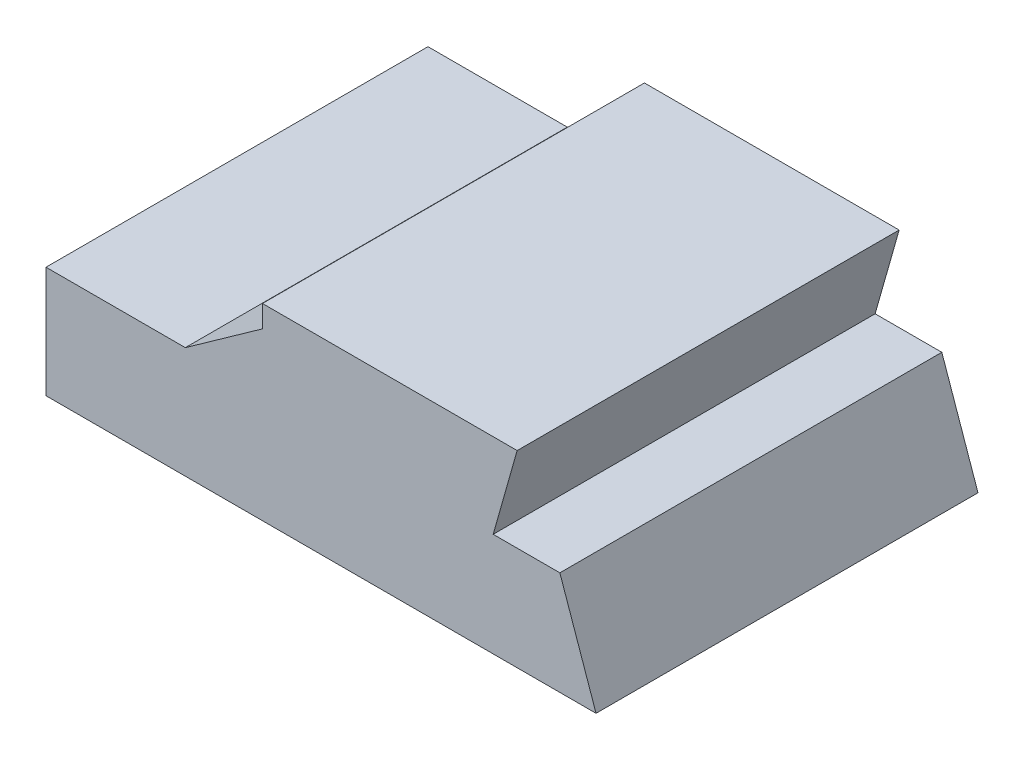
from build123d import *

# Parameters (mm, degrees)
SKETCH_1_R                     = 27.218239916
EXTRUDE_1_DEPTH                = 50
SPLIT_BODIES_1_SURFACE_1_BACK  = 231.852
SPLIT_BODIES_1_SURFACE_1_DEPTH = 463.704
SPLIT_BODIES_1_SURFACE_2_BACK  = 231.852
SPLIT_BODIES_1_SURFACE_2_DEPTH = 463.704


with BuildPart() as part:
    # 草图1 → 凸台-拉伸1 (new, symmetric)
    with BuildSketch(Plane.XY):
        with Locations((126.841, 106.1775)):
            Circle(SKETCH_1_R)
        with BuildLine():
            Line((36.476006197, 29.147891414), (56.67204093, 43.504108875))
            Line((56.67204093, 43.504108875), (56.67204093, 93.307484045))
            Line((56.67204093, 93.307484045), (92.496172884, 93.307484045))
            ThreePointArc((92.496172884, 93.307484045), (88.507151815, 108.556758389), (81.393508143, 122.622629526))
            ThreePointArc((81.393508143, 122.622629526), (81.328816917, 131.844883349), (89.661, 135.798220622))
            Line((89.661, 135.798220622), (152.57565846, 127.931864381))
            ThreePointArc((152.57565846, 127.931864381), (156.589044848, 125.482703859), (157.411382406, 120.853511867))
            Line((157.411382406, 120.853511867), (139.303205185, 49.257428232))
            Line((139.303205185, 49.257428232), (123.353516134, 49.257428232))
            Line((123.353516134, 49.257428232), (117.072161438, 27.122156161))
            Line((117.072161438, 27.122156161), (134.529857437, 27.122156161))
            Line((134.529857437, 27.122156161), (144.001, 0))
            Line((144.001, 0), (0, 0))
            Line((0, 0), (0, 29.147891414))
            Line((0, 29.147891414), (36.476006197, 29.147891414))
        make_face()
    extrude(amount=EXTRUDE_1_DEPTH, both=True)


with BuildPart() as body_2:
    # Split Bodies 1: the piece behind the surface
    add(part.part)
    # Split Bodies 1 surface: a surface, the sketch's curves swept straight by 463.704 mm
    with BuildLine(Plane.XY.offset(50).offset(-SPLIT_BODIES_1_SURFACE_1_BACK), mode=Mode.PRIVATE) as split_bodies_1_surface_1_path:
        Line((123.353516134, 49.257428232), (56.67204093, 49.257428232))
    split_bodies_1_surface_1 = Shell.extrude(split_bodies_1_surface_1_path.wire(), (0 * SPLIT_BODIES_1_SURFACE_1_DEPTH, 0 * SPLIT_BODIES_1_SURFACE_1_DEPTH, 1 * SPLIT_BODIES_1_SURFACE_1_DEPTH))
    split(bisect_by=split_bodies_1_surface_1, keep=Keep.BOTTOM)


with BuildPart() as part_1:
    add(part.part)

    # Split Bodies 1: split by a surface, the side it looks to stays
    # Split Bodies 1 surface: a surface, the sketch's curves swept straight by 463.704 mm
    with BuildLine(Plane.XY.offset(50).offset(-SPLIT_BODIES_1_SURFACE_2_BACK), mode=Mode.PRIVATE) as split_bodies_1_surface_2_path:
        Line((123.353516134, 49.257428232), (56.67204093, 49.257428232))
    split_bodies_1_surface_2 = Shell.extrude(split_bodies_1_surface_2_path.wire(), (0 * SPLIT_BODIES_1_SURFACE_2_DEPTH, 0 * SPLIT_BODIES_1_SURFACE_2_DEPTH, 1 * SPLIT_BODIES_1_SURFACE_2_DEPTH))
    split(bisect_by=split_bodies_1_surface_2, keep=Keep.TOP)


solid = part_1.part
